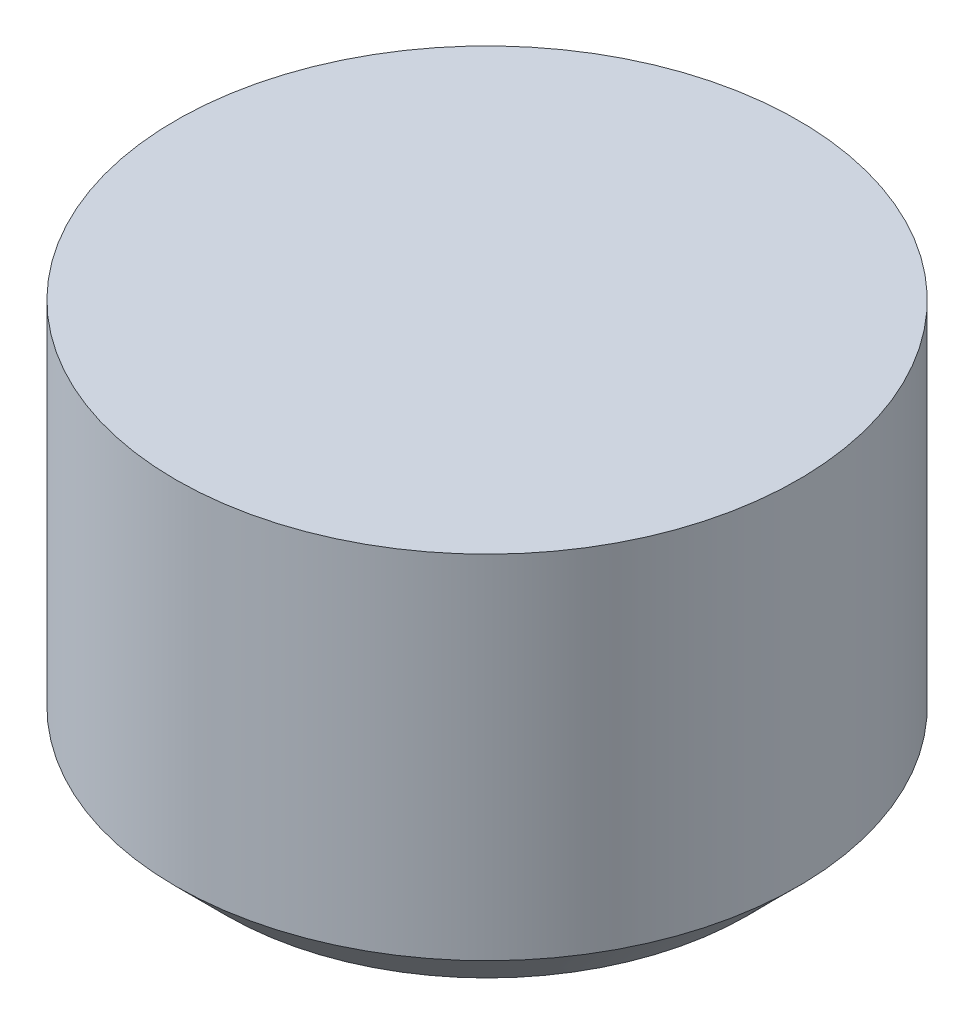
from build123d import *

# Parameters (mm, degrees)
SKETCH_1_R      = 12.2
EXTRUDE_1_DEPTH = 15.8
CHAMFER_1_SIZE  = 2
SKETCH_2_R      = 3
EXTRUDE_2_DEPTH = 4


with BuildPart() as part:
    # 草图1 → 凸台-拉伸1 (new body)
    with BuildSketch(Plane(origin=(0, 0, 0), x_dir=(1, 0, 0), z_dir=(0, 1, 0))):
        with Locations(Location((0, 0, 0), (0, 0, 270))):
            Circle(SKETCH_1_R)
    extrude(amount=EXTRUDE_1_DEPTH)

    # 倒角1
    chamfer_1_edges = [part.edges().sort_by_distance(p)[0] for p in [
        (0, 0, -12.2),
    ]]
    chamfer(chamfer_1_edges, length=CHAMFER_1_SIZE)

    # 草图2 → 凸台-拉伸2 (add)
    with BuildSketch(Plane.XZ):
        with Locations(Location((0, 0, 0), (0, 0, 90))):
            Circle(SKETCH_2_R)
    extrude(amount=EXTRUDE_2_DEPTH)


solid = part.part
